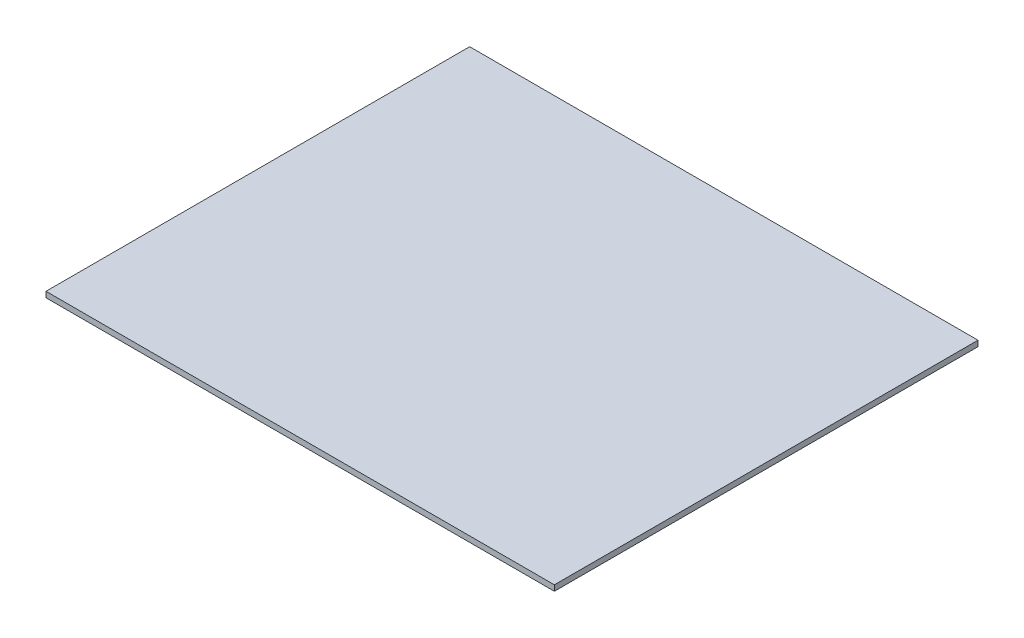
from build123d import *

# Parameters (mm, degrees)
SKETCH_1_W      = 360
SKETCH_1_H      = 300
EXTRUDE_1_DEPTH = 4


with BuildPart() as part:
    # 草图1 → 凸台-拉伸1 (new body)
    with BuildSketch(Plane(origin=(0, 0, 0), x_dir=(1, 0, 0), z_dir=(0, 1, 0))):
        with Locations((180, -150)):
            Rectangle(SKETCH_1_W, SKETCH_1_H)
    extrude(amount=EXTRUDE_1_DEPTH)


solid = part.part
